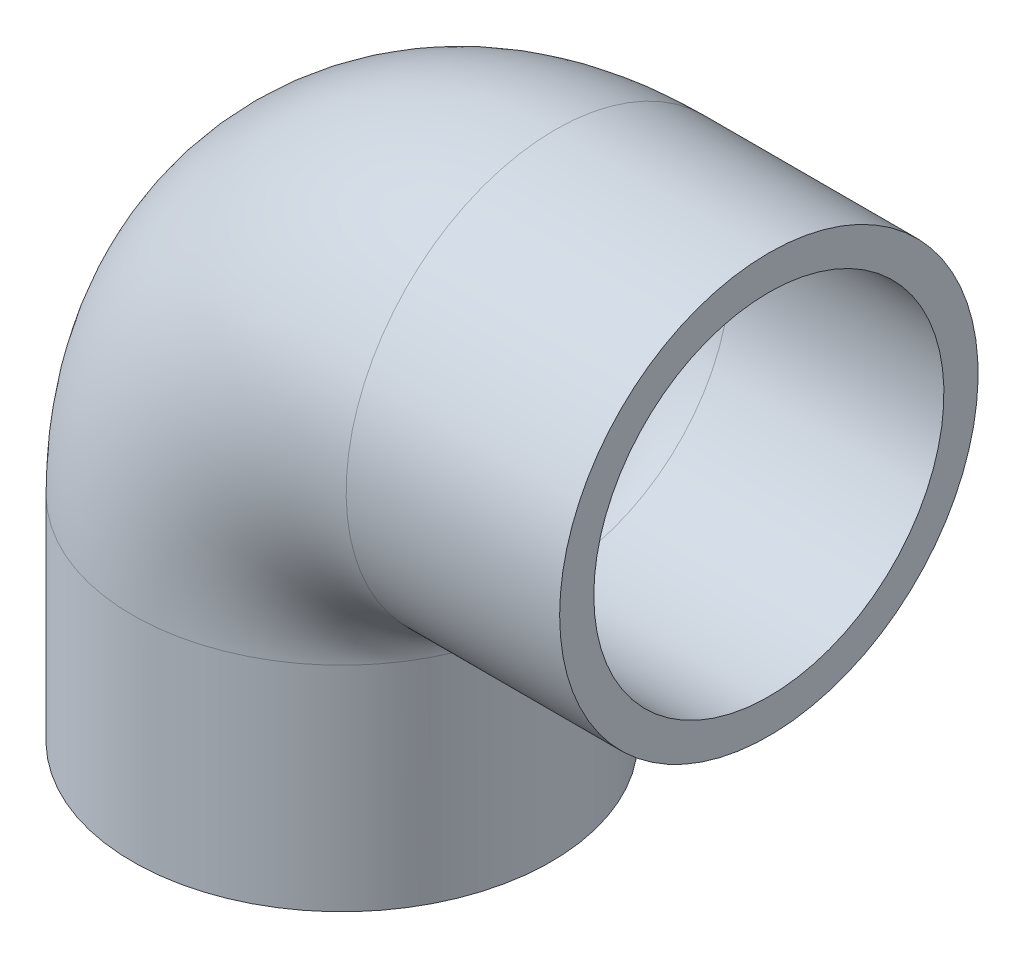
from build123d import *

# Parameters (mm, degrees)
SWEEP_THIN1_PROFILE_R   = 9.8
SWEEP_THIN1_PROFILE_R_2 = 8.2


with BuildPart() as part:
    # Sweep-Thin1: sweep along a path in Sketch1
    with BuildLine(Plane.XY) as sweep_thin1_path:
        Line((-25.308125816, -7.097481779), (-25.308125816, 2.902518221))
        ThreePointArc((-25.308125816, 2.902518221), (-22.379193628, 9.973586033), (-15.308125816, 12.902518221))
        Line((-15.308125816, 12.902518221), (-5.308125816, 12.902518221))
    # Sweep-Thin1 profile (on start of the path) → Sweep-Thin1 (sweep)
    with BuildSketch(Plane(origin=(-25.308125816, -7.097481779, 0), x_dir=(0, 0, 1), z_dir=(0, 1, 0))):
        Circle(SWEEP_THIN1_PROFILE_R)
        Circle(SWEEP_THIN1_PROFILE_R_2, mode=Mode.SUBTRACT)
    sweep(path=sweep_thin1_path.line)


solid = part.part
